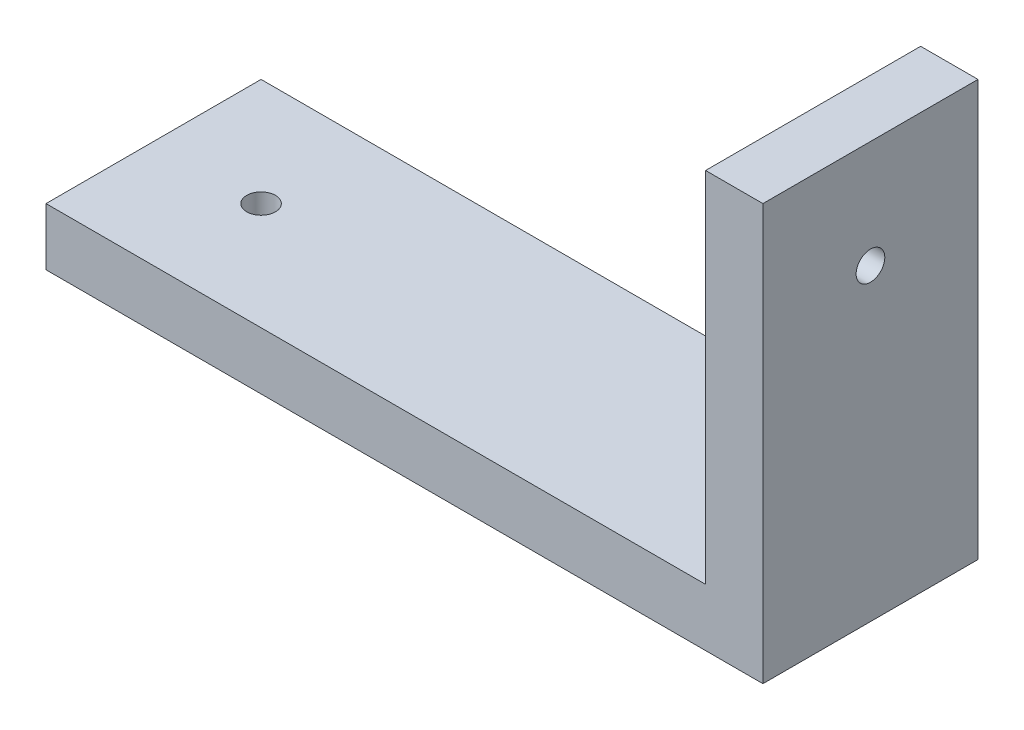
from build123d import *

# Parameters (mm, degrees)
SKETCH1_W           = 100
SKETCH1_H           = 30
SKETCH1_R           = 2
BOSS_EXTRUDE1_DEPTH = 8
SKETCH2_W           = 8
SKETCH2_H           = 30
BOSS_EXTRUDE2_DEPTH = 50
SKETCH3_R           = 2
CUT_EXTRUDE1_DEPTH  = 117.571866246


with BuildPart() as part:
    # Sketch1 → Boss-Extrude1 (new body)
    with BuildSketch(Plane(origin=(0, 0, 0), x_dir=(1, 0, 0), z_dir=(0, 1, 0))):
        Rectangle(SKETCH1_W, SKETCH1_H)
        with Locations(Location((-35, 0, 0), (0, 0, 270))):
            Circle(SKETCH1_R, mode=Mode.SUBTRACT)
    extrude(amount=BOSS_EXTRUDE1_DEPTH)

    # Sketch2 → Boss-Extrude2 (add)
    with BuildSketch(Plane(origin=(0, 8, 0), x_dir=(1, 0, 0), z_dir=(0, 1, 0))):
        with Locations((46, 0)):
            Rectangle(SKETCH2_W, SKETCH2_H)
    extrude(amount=BOSS_EXTRUDE2_DEPTH)

    # Sketch3 → Cut-Extrude1 (cut, through all)
    with BuildSketch(Plane(origin=(50, 0, 0), x_dir=(0, 0, -1), z_dir=(1, 0, 0))):
        with Locations((0, 43)):
            Circle(SKETCH3_R)
    extrude(amount=-CUT_EXTRUDE1_DEPTH, mode=Mode.SUBTRACT)


solid = part.part
